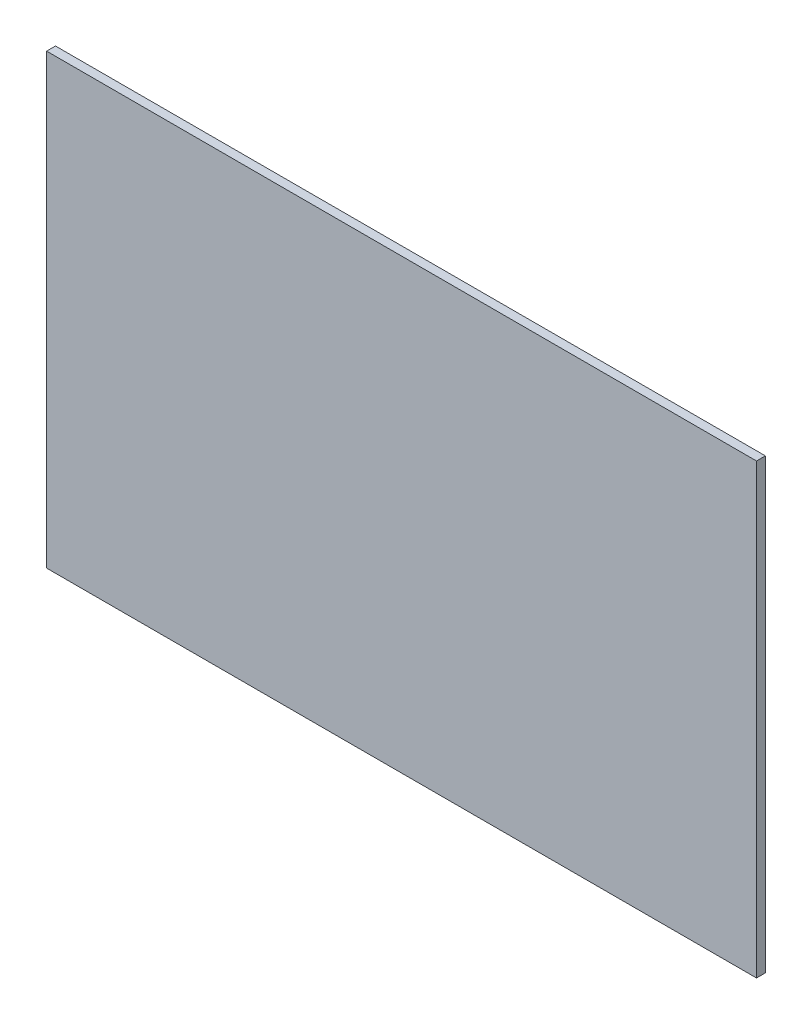
from build123d import *

# Parameters (mm, degrees)
SKETCH1_W           = 762.5
SKETCH1_H           = 480.95
BOSS_EXTRUDE1_DEPTH = 9.525


with BuildPart() as part:
    # Sketch1 → Boss-Extrude1 (new body)
    with BuildSketch(Plane.XY):
        with Locations((381.25, 240.475)):
            Rectangle(SKETCH1_W, SKETCH1_H)
    extrude(amount=BOSS_EXTRUDE1_DEPTH)


solid = part.part
